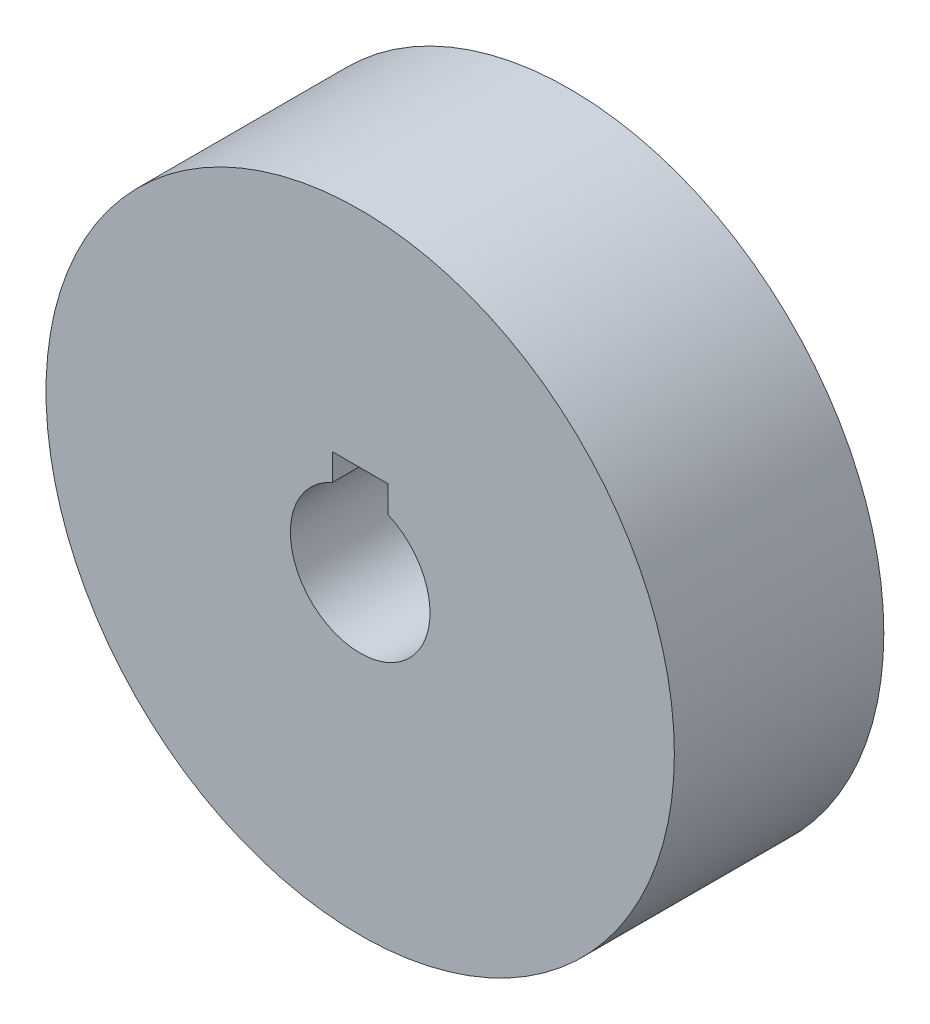
from build123d import *

# Parameters (mm, degrees)
SKETCH1_R           = 45
BOSS_EXTRUDE1_DEPTH = 30


with BuildPart() as part:
    # Sketch1 → Boss-Extrude1 (new body)
    with BuildSketch(Plane.XY):
        Circle(SKETCH1_R)
        with BuildLine():
            Line((4, 9.16515139), (4, 13))
            Line((4, 13), (-4, 13))
            Line((-4, 13), (-4, 9.16515139))
            ThreePointArc((-4, 9.16515139), (0, -10), (4, 9.16515139))
        make_face(mode=Mode.SUBTRACT)
    extrude(amount=BOSS_EXTRUDE1_DEPTH)


solid = part.part
